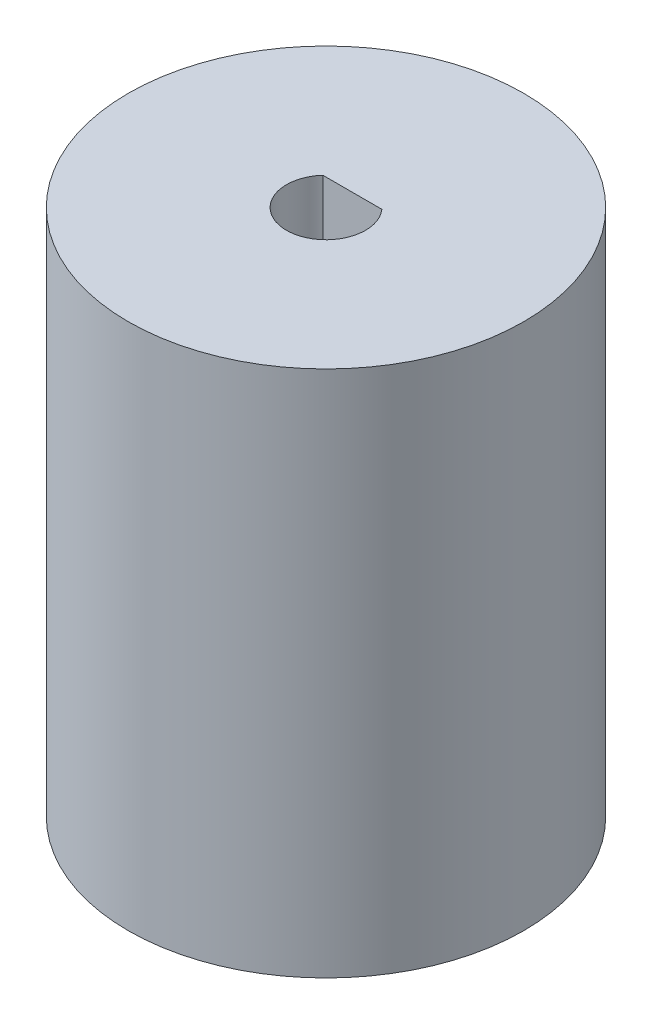
from build123d import *

# Parameters (mm, degrees)
SKETCH1_R           = 7.5
BOSS_EXTRUDE1_DEPTH = 20


with BuildPart() as part:
    # Sketch1 → Boss-Extrude1 (new body)
    with BuildSketch(Plane(origin=(0, 0, 0), x_dir=(1, 0, 0), z_dir=(0, 1, 0))):
        with Locations(Location((0, -1.247872528, 0), (0, 0, 270))):
            Circle(SKETCH1_R)
        with BuildLine():
            Line((-1.118033989, -0.247872528), (1.118033989, -0.247872528))
            ThreePointArc((1.118033989, -0.247872528), (0, -2.747872528), (-1.118033989, -0.247872528))
        make_face(mode=Mode.SUBTRACT)
    extrude(amount=BOSS_EXTRUDE1_DEPTH)


solid = part.part
